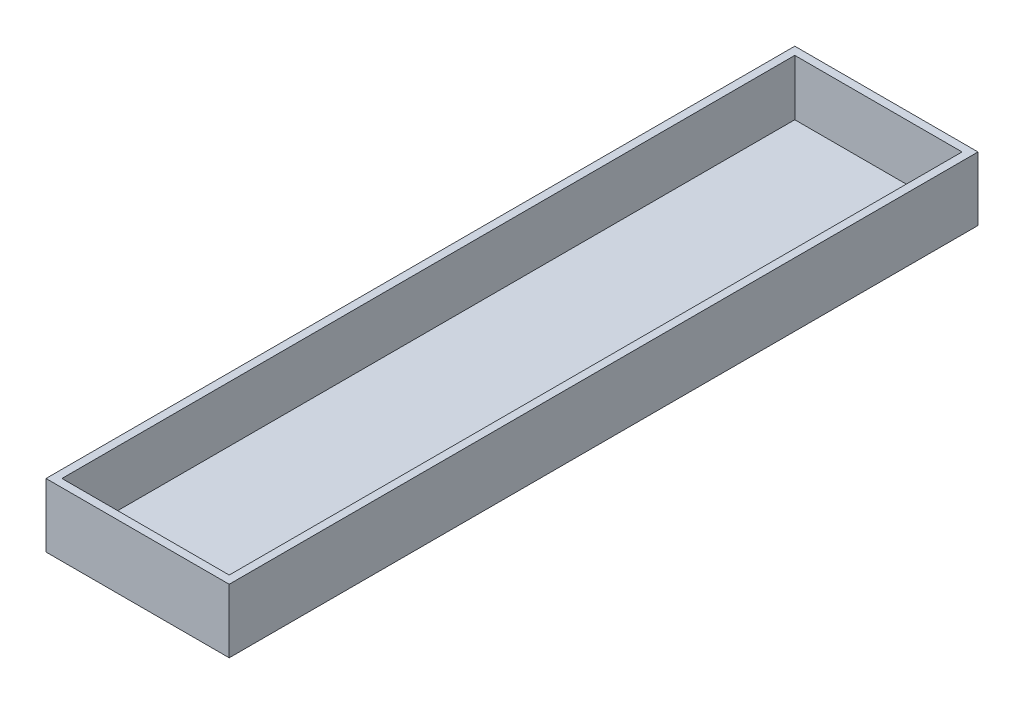
from build123d import *

# Parameters (mm, degrees)
SKETCH1_W           = 23000
SKETCH1_H           = 8000
BOSS_EXTRUDE2_DEPTH = 94000
SKETCH2_W           = 21000
SKETCH2_H           = 92000
CUT_EXTRUDE1_DEPTH  = 7000


with BuildPart() as part:
    # Sketch1 → Boss-Extrude2 (new body)
    with BuildSketch(Plane.XY):
        with Locations((11500, 4000)):
            Rectangle(SKETCH1_W, SKETCH1_H)
    extrude(amount=BOSS_EXTRUDE2_DEPTH)

    # Sketch2 → Cut-Extrude1 (cut)
    with BuildSketch(Plane(origin=(0, 8000, 0), x_dir=(1, 0, 0), z_dir=(0, 1, 0))):
        with Locations((11500, -47000)):
            Rectangle(SKETCH2_W, SKETCH2_H)
    extrude(amount=-CUT_EXTRUDE1_DEPTH, mode=Mode.SUBTRACT)


solid = part.part
